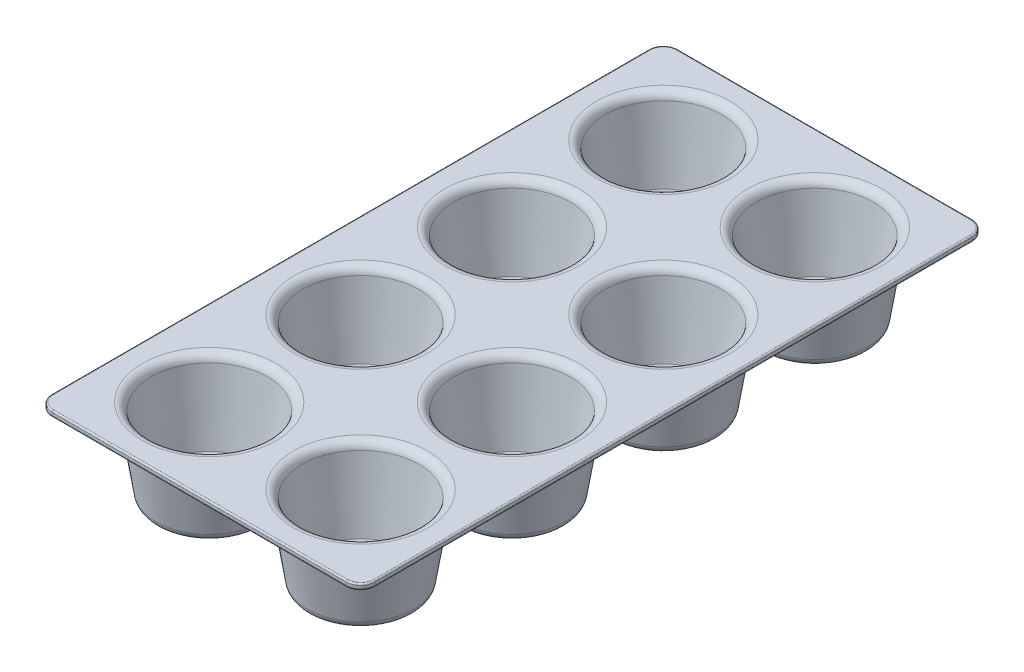
from build123d import *

# Parameters (mm, degrees)
LPATTERN1_COUNT     = 2
LPATTERN1_PITCH     = 104
LPATTERN1_2_COUNT   = 4
LPATTERN1_2_PITCH   = 104
SKETCH2_R           = 47
BOSS_EXTRUDE1_DEPTH = 4
FILLET1_R           = 1


with BuildPart() as part:
    # Sketch1 → Revolve1 (revolve)
    with BuildSketch(Plane(origin=(0, 0, 0), x_dir=(0, 0, -1), z_dir=(1, 0, 0))):
        with BuildLine():
            Line((0, -58), (-30.614594739, -58))
            ThreePointArc((-30.614594739, -58), (-34.511283029, -56.562435794), (-36.540724782, -52.93860679))
            Line((-36.540724782, -52.93860679), (-44.024623319, -5.68713107))
            ThreePointArc((-44.024623319, -5.68713107), (-44.701103903, -4.479188069), (-46, -4))
            Line((-46, -4), (-47, -4))
            Line((-47, -4), (-47, 0))
            Line((-47, 0), (-46, 0))
            ThreePointArc((-46, 0), (-42.10331171, -1.437564206), (-40.073869956, -5.06139321))
            Line((-40.073869956, -5.06139321), (-32.58997142, -52.31286893))
            ThreePointArc((-32.58997142, -52.31286893), (-31.913490835, -53.520811931), (-30.614594739, -54))
            Line((-30.614594739, -54), (0, -54))
            Line((0, -54), (0, -58))
        make_face()
    revolve(axis=Axis((0, 0, 0), (0, -1, 0)))


with BuildPart() as lpattern1_1:
    # LPattern1: pattern copy
    add(part.part.moved(Location(Vector(1, 0, 0) * (1 * LPATTERN1_PITCH))))


with BuildPart() as lpattern1_2_1:
    # LPattern1 2: pattern copy
    add(part.part.moved(Location(Vector(0, 0, 1) * (1 * LPATTERN1_2_PITCH))))


with BuildPart() as lpattern1_2_2:
    # LPattern1 2: pattern copy
    add(part.part.moved(Location(Vector(0, 0, 1) * (2 * LPATTERN1_2_PITCH))))


with BuildPart() as lpattern1_2_3:
    # LPattern1 2: pattern copy
    add(part.part.moved(Location(Vector(0, 0, 1) * (3 * LPATTERN1_2_PITCH))))


with BuildPart() as lpattern1_2_4:
    # LPattern1 2: pattern copy
    add(lpattern1_1.part.moved(Location(Vector(0, 0, 1) * (1 * LPATTERN1_2_PITCH))))


with BuildPart() as lpattern1_2_5:
    # LPattern1 2: pattern copy
    add(lpattern1_1.part.moved(Location(Vector(0, 0, 1) * (2 * LPATTERN1_2_PITCH))))


with BuildPart() as lpattern1_2_6:
    # LPattern1 2: pattern copy
    add(lpattern1_1.part.moved(Location(Vector(0, 0, 1) * (3 * LPATTERN1_2_PITCH))))


with BuildPart() as part_1:
    add(part.part)

    add(lpattern1_1.part)  # Boss-Extrude1 merges LPattern1_1

    add(lpattern1_2_1.part)  # Boss-Extrude1 merges LPattern1 2_1

    add(lpattern1_2_2.part)  # Boss-Extrude1 merges LPattern1 2_2

    add(lpattern1_2_3.part)  # Boss-Extrude1 merges LPattern1 2_3

    add(lpattern1_2_4.part)  # Boss-Extrude1 merges LPattern1 2_4

    add(lpattern1_2_5.part)  # Boss-Extrude1 merges LPattern1 2_5

    add(lpattern1_2_6.part)  # Boss-Extrude1 merges LPattern1 2_6
    # Sketch2 → Boss-Extrude1 (add)
    with BuildSketch(Plane(origin=(0, 0, 0), x_dir=(1, 0, 0), z_dir=(0, 1, 0))):
        with BuildLine():
            Line((-49, -371), (153, -371))
            ThreePointArc((153, -371), (160.071067812, -368.071067812), (163, -361))
            Line((163, -361), (163, 49))
            ThreePointArc((163, 49), (160.071067812, 56.071067812), (153, 59))
            Line((153, 59), (-49, 59))
            ThreePointArc((-49, 59), (-56.071067812, 56.071067812), (-59, 49))
            Line((-59, 49), (-59, -361))
            ThreePointArc((-59, -361), (-56.071067812, -368.071067812), (-49, -371))
        make_face()
        with Locations((0, -312)):
            Circle(SKETCH2_R, mode=Mode.SUBTRACT)
        with Locations((104, -312)):
            Circle(SKETCH2_R, mode=Mode.SUBTRACT)
        with Locations((104, -208)):
            Circle(SKETCH2_R, mode=Mode.SUBTRACT)
        with Locations((0, -208)):
            Circle(SKETCH2_R, mode=Mode.SUBTRACT)
        with Locations((0, -104)):
            Circle(SKETCH2_R, mode=Mode.SUBTRACT)
        with Locations((104, -104)):
            Circle(SKETCH2_R, mode=Mode.SUBTRACT)
        with Locations((104, 0)):
            Circle(SKETCH2_R, mode=Mode.SUBTRACT)
        Circle(SKETCH2_R, mode=Mode.SUBTRACT)
    extrude(amount=-BOSS_EXTRUDE1_DEPTH)

    # Fillet1
    fillet1_edges = [part_1.edges().sort_by_distance(p)[0] for p in [
        (-56.071067812, -4, -56.071067812),
        (52, -4, -59),
        (160.071067812, -4, -56.071067812),
        (163, -4, 156),
        (160.071067812, -4, 368.071067812),
        (52, -4, 371),
        (-56.071067812, -4, 368.071067812),
        (-59, -4, 156),
        (-56.071067812, 0, -56.071067812),
        (-59, 0, 156),
        (-56.071067812, 0, 368.071067812),
        (52, 0, 371),
        (160.071067812, 0, 368.071067812),
        (163, 0, 156),
        (160.071067812, 0, -56.071067812),
        (52, 0, -59),
    ]]
    fillet(fillet1_edges, radius=FILLET1_R)


solid = part_1.part
